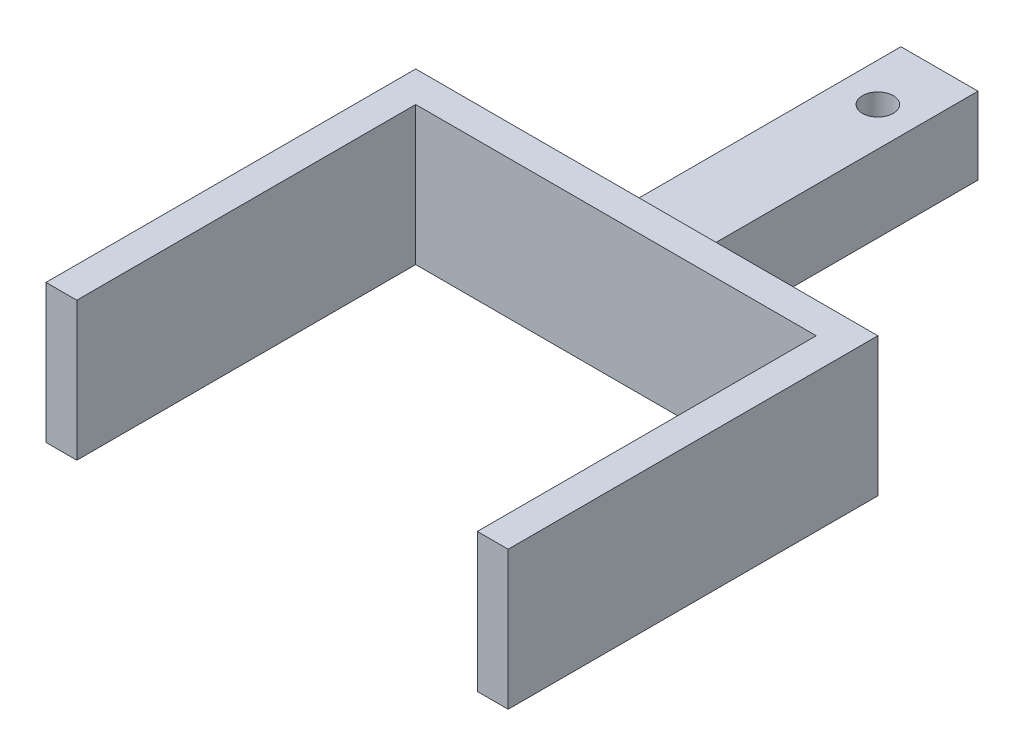
from build123d import *

# Parameters (mm, degrees)
ESQUISSE1_W             = 25
ESQUISSE1_H             = 25
BOSS_EXTRU_1_DEPTH      = 95
ESQUISSE2_W             = 130
ESQUISSE2_H             = 45
BOSS_EXTRU_2_DEPTH      = 10
ESQUISSE4_W             = 10
ESQUISSE4_H             = 120
BOSS_EXTRU_3_DEPTH      = 45
ESQUISSE5_R             = 5
ENL_V_MAT_EXTRU_1_DEPTH = 235.747204456
ESQUISSE6_R             = 9.997992339
ENL_V_MAT_EXTRU_2_DEPTH = 10


with BuildPart() as part:
    # Esquisse1 → Boss.-Extru.1 (new body)
    with BuildSketch(Plane.XY):
        with Locations((-12.5, -12.5)):
            Rectangle(ESQUISSE1_W, ESQUISSE1_H)
    extrude(amount=BOSS_EXTRU_1_DEPTH)

    # Esquisse2 → Boss.-Extru.2 (add)
    with BuildSketch(Plane.XY.offset(95)):
        with Locations((-12.5, -12.5)):
            Rectangle(ESQUISSE2_W, ESQUISSE2_H)
    extrude(amount=BOSS_EXTRU_2_DEPTH)

    # Esquisse4 → Boss.-Extru.3 (add)
    with BuildSketch(Plane(origin=(0, 10, 0), x_dir=(1, 0, 0), z_dir=(0, 1, 0))):
        with Locations((-82.5, -155)):
            Rectangle(ESQUISSE4_W, ESQUISSE4_H)
        with Locations((57.5, -155)):
            Rectangle(ESQUISSE4_W, ESQUISSE4_H)
    extrude(amount=-BOSS_EXTRU_3_DEPTH)

    # Esquisse5 → Enlèv. mat.-Extru.1 (cut, through all)
    with BuildSketch(Plane(origin=(0, 0, 0), x_dir=(1, 0, 0), z_dir=(0, 1, 0))):
        with Locations(Location((-12.5, -20, 0), (0, 0, 270))):
            Circle(ESQUISSE5_R)
    extrude(amount=-ENL_V_MAT_EXTRU_1_DEPTH, mode=Mode.SUBTRACT)

    # Esquisse6 → Enlèv. mat.-Extru.2 (cut)
    with BuildSketch(Plane.XZ.offset(25)):
        with Locations(Location((-12.5, 20, 0), (0, 0, 270))):
            Circle(ESQUISSE6_R)
    extrude(amount=-ENL_V_MAT_EXTRU_2_DEPTH, mode=Mode.SUBTRACT)


solid = part.part
